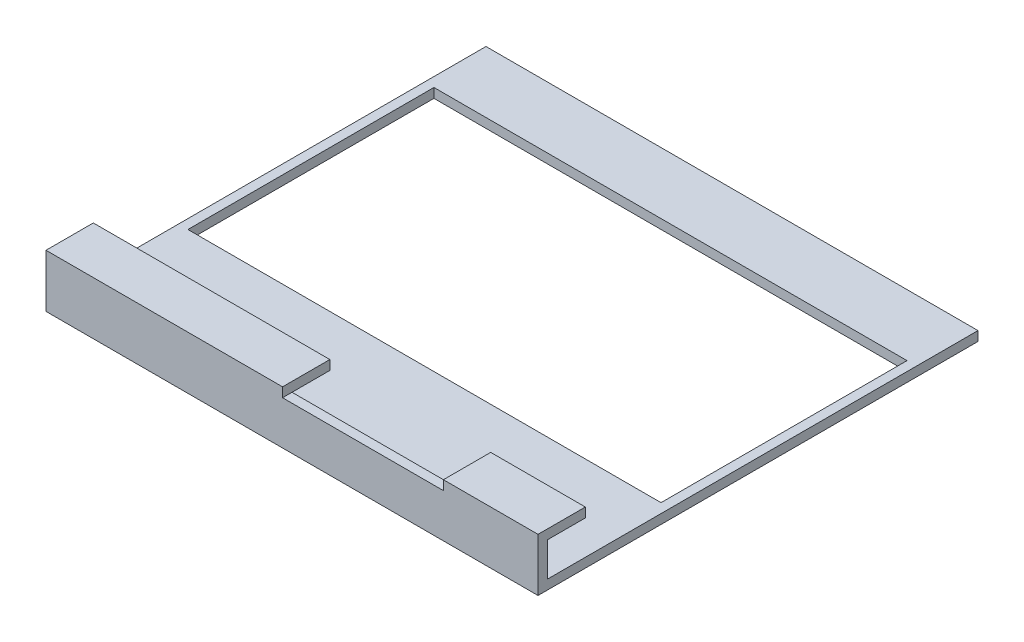
from build123d import *

# Parameters (mm, degrees)
BOSS_EXTRUDE1_DEPTH = 104
SKETCH2_W           = 34
SKETCH2_H           = 10
CUT_EXTRUDE1_DEPTH  = 2
CUT_EXTRUDE2_REACH  = 141.82
SKETCH3_W           = 100
SKETCH3_H           = 52


with BuildPart() as part:
    # Sketch1 → Boss-Extrude1 (new body)
    with BuildSketch(Plane(origin=(0, 0, 0), x_dir=(0, 0, -1), z_dir=(1, 0, 0))):
        Polygon((0, 0), (93, 0), (93, 2), (2, 2), (2, 9.2), (10, 9.2), (10, 11.2), (0, 11.2), align=None)
    extrude(amount=BOSS_EXTRUDE1_DEPTH)

    # Sketch2 → Cut-Extrude1 (cut)
    with BuildSketch(Plane(origin=(0, 11.2, 0), x_dir=(1, 0, 0), z_dir=(0, 1, 0))):
        with Locations((67, 5)):
            Rectangle(SKETCH2_W, SKETCH2_H)
    extrude(amount=-CUT_EXTRUDE1_DEPTH, mode=Mode.SUBTRACT)

    # Sketch3 → Cut-Extrude2 (cut, up to next)
    with BuildSketch(Plane(origin=(0, 2, 0), x_dir=(1, 0, 0), z_dir=(0, 1, 0)), mode=Mode.PRIVATE) as cut_extrude2_sk1:
        with Locations((52, 54)):
            Rectangle(SKETCH3_W, SKETCH3_H)
    cut_extrude2_tool1 = extrude(cut_extrude2_sk1.sketch, amount=-CUT_EXTRUDE2_REACH, mode=Mode.PRIVATE) & part.part
    add(cut_extrude2_tool1.solids().sort_by_distance((52, 2, -54))[0], mode=Mode.SUBTRACT)


solid = part.part
